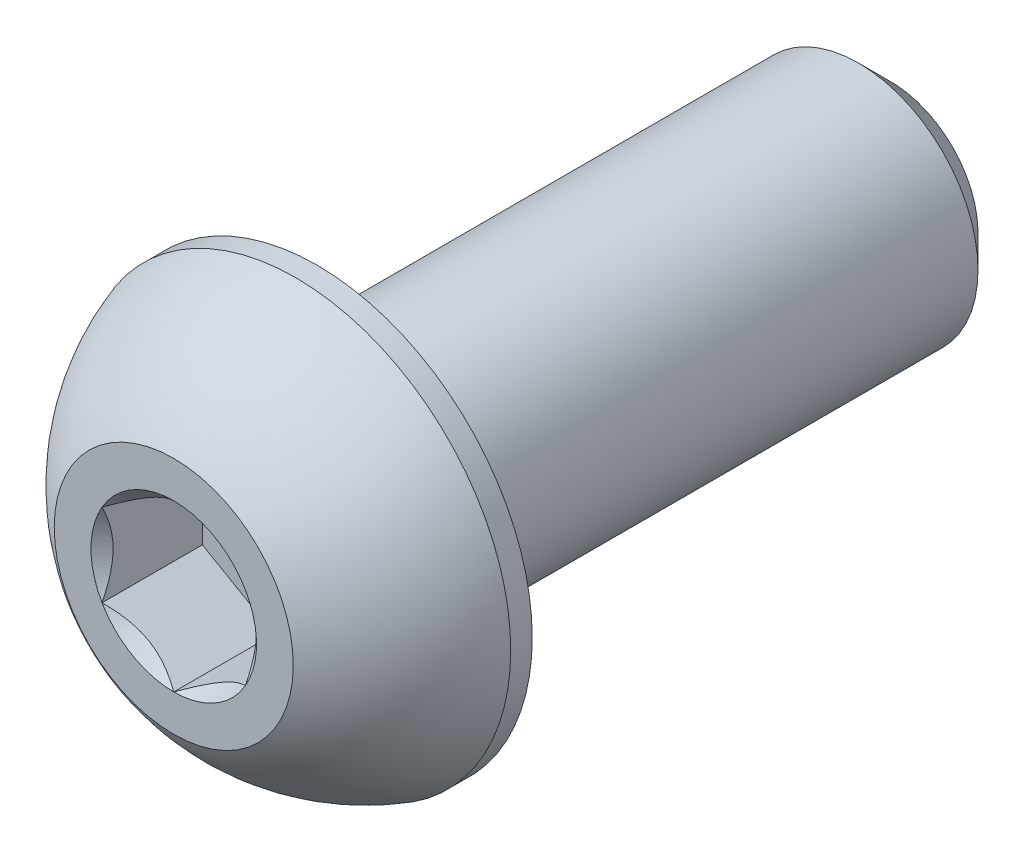
from build123d import *

# Parameters (mm, degrees)
CUT_EXTRUDE2_DEPTH = 1.05


with BuildPart() as part:
    # Sketch10 → Revolve3 (revolve)
    with BuildSketch(Plane(origin=(0, 0, 0), x_dir=(0, 0, -1), z_dir=(1, 0, 0))):
        Polygon((2.6625, 1.25), (3, 0.9125), (3, 0), (-3, 0), (-3, 1.25), align=None)
    revolve(axis=Axis((0, 0, 4.5), (0, 0, -1)))

    # Sketch7 → Revolve2 (revolve)
    with BuildSketch(Plane(origin=(0, 0, 0), x_dir=(0, 0, -1), z_dir=(1, 0, 0))):
        with BuildLine():
            Line((-3.225, 2.25), (-3, 2.25))
            Line((-3, 2.25), (-3, 0))
            Line((-3, 0), (-4.5, 0))
            Line((-4.5, 0), (-4.5, 1.25))
            ThreePointArc((-4.5, 1.25), (-3.950735294, 1.8625), (-3.225, 2.25))
        make_face()
    revolve(axis=Axis((0, 0, 4.5), (0, 0, -1)))

    # Sketch5 → Cut-Extrude2 (cut)
    with BuildSketch(Plane.XY.offset(4.5)):
        Polygon((0.75, -0.433012702), (0.75, 0.433012702), (0, 0.866025404), (-0.75, 0.433012702), (-0.75, -0.433012702), (0, -0.866025404), align=None)
    extrude(amount=-CUT_EXTRUDE2_DEPTH, mode=Mode.SUBTRACT)

    # Cut-Extrude3 cone 1 section (through the dimple's axis) → Cut-Extrude3 (revolve, cut)
    with BuildSketch(Plane(origin=(0, 0, 4.5), x_dir=(0, -1, 0), z_dir=(1, 0, 0))):
        Polygon((0, 0), (0.866025404, 0), (0, 0.866025404), align=None)
    revolve(axis=Axis((0, 0, 4.5), (0, 0, -1)), mode=Mode.SUBTRACT)


solid = part.part
